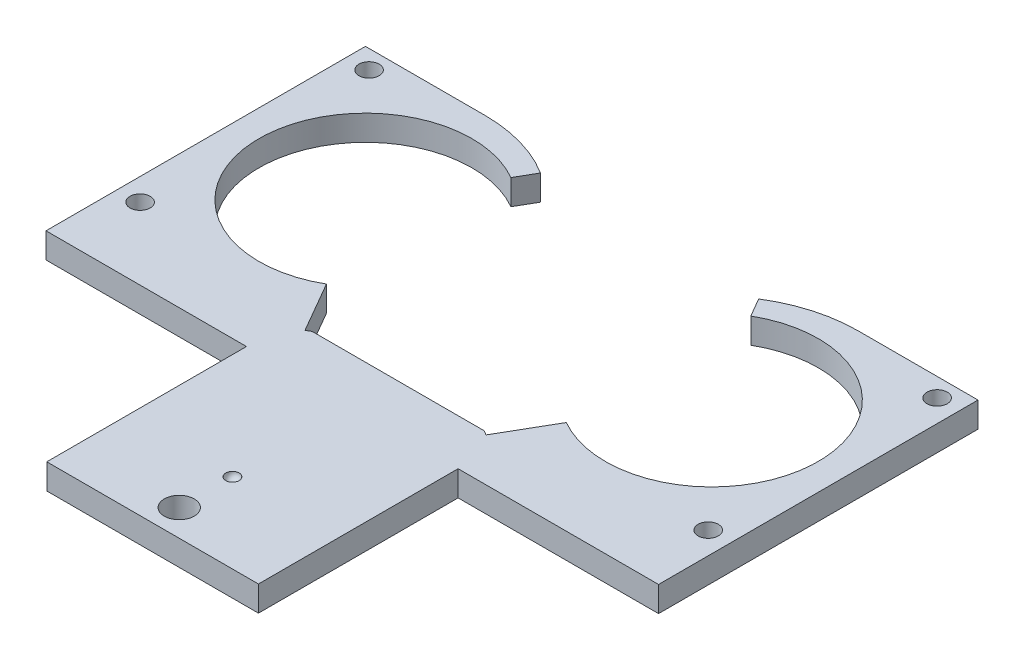
from build123d import *

# Parameters (mm, degrees)
CROQUIS1_R              = 8
CROQUIS1_R_2            = 0.76
SALIENTE_EXTRUIR1_DEPTH = 1.9
CORTAR_EXTRUIR1_START   = -10
CORTAR_EXTRUIR1_DEPTH   = 10
CROQUIS5_R              = 1.125
CORTAR_EXTRUIR2_DEPTH   = 52.936984895


with BuildPart() as part:
    # Croquis1 → Saliente-Extruir1 (new body)
    with BuildSketch(Plane(origin=(0, 0, 0), x_dir=(1, 0, 0), z_dir=(0, 1, 0))):
        with BuildLine():
            Line((16.42006532, 3.45), (29.59993468, 3.45))
            ThreePointArc((29.59993468, 3.45), (26.951107015, 7.365390191), (26.02, 12))
            Line((26.02, 12), (26.02, 13))
            ThreePointArc((26.02, 13), (29.241825407, 20.778174593), (37.02, 24))
            Line((37.02, 24), (46.02, 24))
            Line((46.02, 24), (46.02, 0))
            Line((46.02, 0), (30.96, 0))
            Line((30.96, 0), (30.96, -15))
            Line((30.96, -15), (15.06, -15))
            Line((15.06, -15), (15.06, 0))
            Line((15.06, 0), (0, 0))
            Line((0, 0), (0, 24))
            Line((0, 24), (9, 24))
            ThreePointArc((9, 24), (16.778174593, 20.778174593), (20, 13))
            Line((20, 13), (20, 12))
            ThreePointArc((20, 12), (19.068892985, 7.365390191), (16.42006532, 3.45))
        make_face()
        with Locations(Location((10, 14, 0), (0, 0, 90))):
            Circle(CROQUIS1_R, mode=Mode.SUBTRACT)
        with Locations(Location((1.67, 22.6, 0), (0, 0, 90))):
            Circle(CROQUIS1_R_2, mode=Mode.SUBTRACT)
        with Locations(Location((1.67, 5.4, 0), (0, 0, 90))):
            Circle(CROQUIS1_R_2, mode=Mode.SUBTRACT)
        with Locations(Location((36.02, 14, 0), (0, 0, 90))):
            Circle(CROQUIS1_R, mode=Mode.SUBTRACT)
        with Locations(Location((44.35, 5.4, 0), (0, 0, 90))):
            Circle(CROQUIS1_R_2, mode=Mode.SUBTRACT)
        with Locations(Location((44.35, 22.6, 0), (0, 0, 90))):
            Circle(CROQUIS1_R_2, mode=Mode.SUBTRACT)
    extrude(amount=SALIENTE_EXTRUIR1_DEPTH)

    # Croquis2 → Cortar-Extruir1 (cut)
    with BuildSketch(Plane(origin=(0, 1.9, 0), x_dir=(1, 0, 0), z_dir=(0, 1, 0)).offset(CORTAR_EXTRUIR1_START)):
        with BuildLine():
            Line((16.208454231, 24.753358164), (14, 20.92820323))
            ThreePointArc((14, 20.92820323), (18, 14), (14, 7.07179677))
            Line((14, 7.07179677), (16.208454231, 3.246641836))
            ThreePointArc((16.208454231, 3.246641836), (22.416908461, 14), (16.208454231, 24.753358164))
        make_face()
        with BuildLine():
            Line((32.02, 7.07179677), (29.811545769, 3.246641836))
            ThreePointArc((29.811545769, 3.246641836), (23.603091539, 14), (29.811545769, 24.753358164))
            Line((29.811545769, 24.753358164), (32.02, 20.92820323))
            ThreePointArc((32.02, 20.92820323), (28.02, 14), (32.02, 7.07179677))
        make_face()
    extrude(amount=CORTAR_EXTRUIR1_DEPTH, mode=Mode.SUBTRACT)

    # Croquis4 → Cortar-Revolución1 (revolve, cut)
    with BuildSketch(Plane.XY.offset(9)):
        with BuildLine():
            Line((22.51, 1.9), (23.51, 1.9))
            ThreePointArc((23.51, 1.9), (23.01, 1.4), (22.51, 1.9))
        make_face()
    revolve(axis=Axis((-976.99, 1.9, 9), (1, 0, 0)), mode=Mode.SUBTRACT)

    # Croquis5 → Cortar-Extruir2 (cut, through all)
    with BuildSketch(Plane(origin=(0, 1.9, 0), x_dir=(1, 0, 0), z_dir=(0, 1, 0))):
        with Locations(Location((23.01, -13, 0), (0, 0, 270))):
            Circle(CROQUIS5_R)
    extrude(amount=-CORTAR_EXTRUIR2_DEPTH, mode=Mode.SUBTRACT)


solid = part.part
